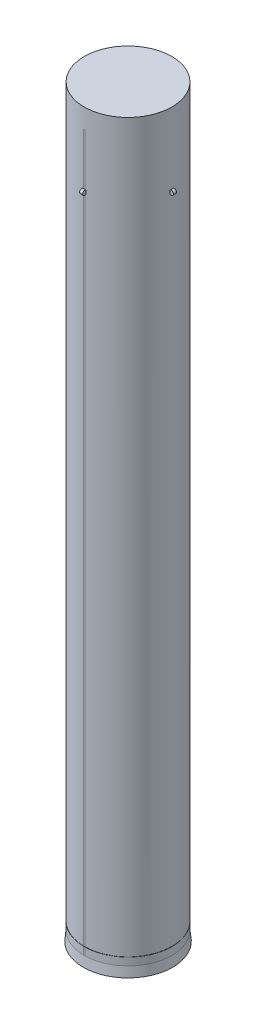
from build123d import *

# Parameters (mm, degrees)
SKETCH2_R           = 10
SKETCH6_R           = 220
BOSS_EXTRUDE1_DEPTH = 160
CIRPATTERN1_COUNT   = 4
SKETCH7_W           = 100
SKETCH7_H           = 73500
BOSS_EXTRUDE2_DEPTH = 100


with BuildPart() as part:
    # Sketch1 → Revolve1 (revolve)
    with BuildSketch(Plane.XY, mode=Mode.PRIVATE) as revolve1_sk:
        Polygon((0, 76500), (4500, 76500), (4500, 1000), (4600, 0), (4300, 0), (4300, 1000), (4300, 73000), (0, 75000), align=None)
    revolve(revolve1_sk.sketch.rotate(Axis((0, 0, 0), (0, 1, 0)), 90), axis=Axis((0, 0, 0), (0, 1, 0)))

    # Sketch2 → Revolve2 (revolve)
    with BuildSketch(Plane.XY, mode=Mode.PRIVATE) as revolve2_sk:
        with Locations((4506, 1800)):
            Circle(SKETCH2_R)
    revolve(revolve2_sk.sketch.rotate(Axis((0, 0, 0), (0, 1, 0)), 90), axis=Axis((0, 0, 0), (0, 1, 0)))

    # Sketch6 → Boss-Extrude1 (add, symmetric)
    with BuildSketch(Plane.XY):
        with Locations((4600, 69000)):
            Circle(SKETCH6_R)
    boss_extrude1 = extrude(amount=BOSS_EXTRUDE1_DEPTH, both=True)

    # CirPattern1: Boss-Extrude1 ×4 about axis
    cirpattern1_axis = Axis((0, 0, 0), (0, 1, 0))
    for i in range(1, CIRPATTERN1_COUNT):
        add(boss_extrude1.rotate(cirpattern1_axis, i * 360 / CIRPATTERN1_COUNT))

    # Sketch7 → Boss-Extrude2 (add, symmetric)
    with BuildSketch(Plane(origin=(0, 0, 0), x_dir=(0, 0, -1), z_dir=(1, 0, 0))):
        with Locations((4450, 37750)):
            Rectangle(SKETCH7_W, SKETCH7_H)
        Polygon((-4500, 74500), (-4500, 1000), (-4400, 1000), align=None)
    extrude(amount=BOSS_EXTRUDE2_DEPTH, both=True)


solid = part.part
